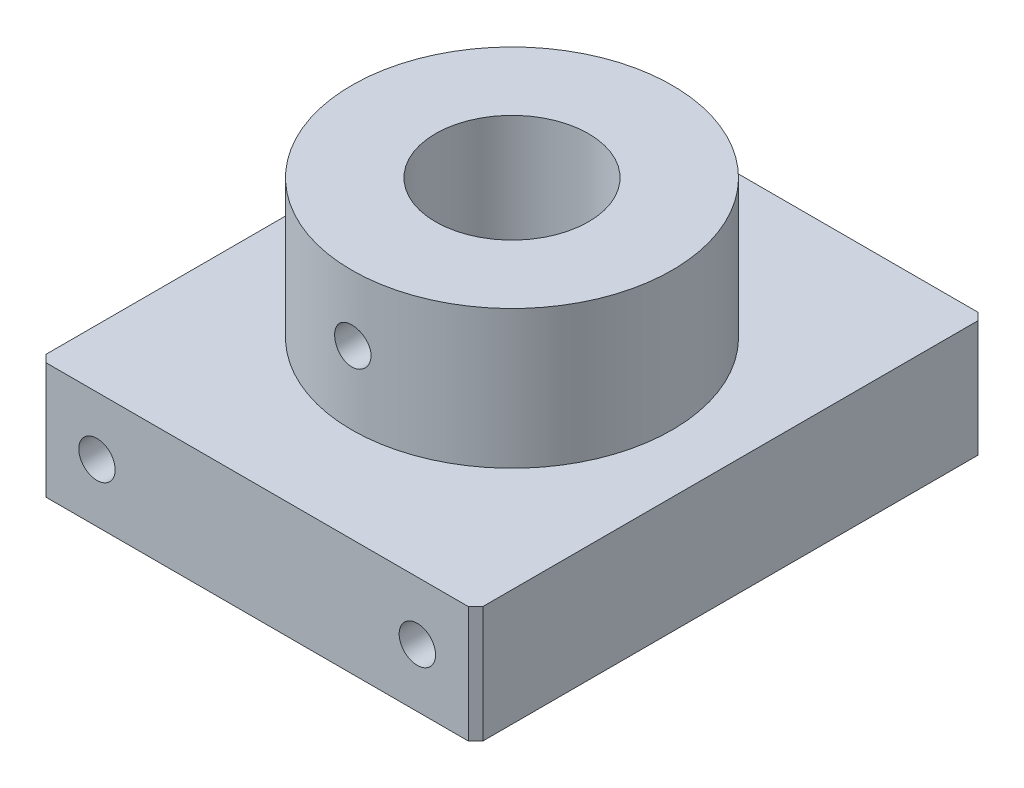
from build123d import *

# Parameters (mm, degrees)
SKETCH_1_W                  = 30
SKETCH_1_H                  = 35
EXTRUDE_1_DEPTH             = 10
SKETCH_3_R                  = 11
SKETCH_3_R_2                = 5.25
EXTRUDE_2_DEPTH             = 8.5
CHAMFER_1_SIZE              = 0.5
SKETCH_6_R                  = 5.25
CUT_EXTRUDE_3_DEPTH         = 30.555033412
SKETCH_7_W                  = 31.194113832
SKETCH_7_H                  = 36.870983812
CUT_EXTRUDE_4_DEPTH         = 1
CUT_EXTRUDE_START           = -1
SKETCH_8_W                  = 33.487798672
SKETCH_8_H                  = 37.788457748
SKETCH_8_R                  = 11
CUT_EXTRUDE_5_DEPTH         = 1
HOLE_WIZARD_M3_1_AT_2_COUNT = 2
HOLE_WIZARD_M3_1_AT_2_PITCH = 22
SKETCH_4_R                  = 1.25
CUT_EXTRUDE_6_DEPTH         = 30.555033412


with BuildPart() as part:
    # 草图1 → 凸台-拉伸1 (new body)
    with BuildSketch(Plane(origin=(0, 0, 0), x_dir=(1, 0, 0), z_dir=(0, 1, 0))):
        Rectangle(SKETCH_1_W, SKETCH_1_H)
    extrude(amount=EXTRUDE_1_DEPTH)

    # 草图3 → 凸台-拉伸2 (add)
    with BuildSketch(Plane(origin=(0, 10, 0), x_dir=(1, 0, 0), z_dir=(0, 1, 0))):
        with Locations(Location((0, 0, 0), (0, 0, 270))):
            Circle(SKETCH_3_R)
        with Locations(Location((0, 0, 0), (0, 0, 270))):
            Circle(SKETCH_3_R_2, mode=Mode.SUBTRACT)
    extrude(amount=EXTRUDE_2_DEPTH)

    # 倒角1
    chamfer_1_edges = [part.edges().sort_by_distance(p)[0] for p in [
        (15, 5, 17.5),
        (-15, 5, 17.5),
        (-15, 5, -17.5),
        (15, 5, -17.5),
    ]]
    chamfer(chamfer_1_edges, length=CHAMFER_1_SIZE)

    # 草图6 → 切除-拉伸3 (cut, through all)
    with BuildSketch(Plane(origin=(0, 18.5, 0), x_dir=(1, 0, 0), z_dir=(0, 1, 0))):
        with Locations(Location((0, 0, 0), (0, 0, 270))):
            Circle(SKETCH_6_R)
    extrude(amount=-CUT_EXTRUDE_3_DEPTH, mode=Mode.SUBTRACT)

    # 草图7 → 切除-拉伸4 (cut)
    with BuildSketch(Plane.XZ):
        Rectangle(SKETCH_7_W, SKETCH_7_H)
    extrude(amount=-CUT_EXTRUDE_4_DEPTH, mode=Mode.SUBTRACT)

    # 草图8 → 切除-拉伸5 (cut)
    with BuildSketch(Plane(origin=(0, 10, 0), x_dir=(1, 0, 0), z_dir=(0, 1, 0)).offset(CUT_EXTRUDE_START)):
        Rectangle(SKETCH_8_W, SKETCH_8_H)
        with Locations(Location((0, 0, 0), (0, 0, 270))):
            Circle(SKETCH_8_R, mode=Mode.SUBTRACT)
    extrude(amount=CUT_EXTRUDE_5_DEPTH, mode=Mode.SUBTRACT)

    # 草图9 → M3 螺纹孔1 (revolve, cut)
    with BuildSketch(Plane(origin=(-11, 5, 17.5), x_dir=(0, -1, 0), z_dir=(1, 0, 0))):
        Polygon((0, 0), (0, 8.751075774), (1.25, 8), (1.25, 0), align=None)
    hole_wizard_m3_1 = revolve(axis=Axis((-11, 5, 23.85), (0, 0, -1)), mode=Mode.SUBTRACT)

    # M3 螺纹孔1 at 2: M3 螺纹孔1 ×2
    with Locations(*[(i * HOLE_WIZARD_M3_1_AT_2_PITCH, 0, 0) for i in range(1, HOLE_WIZARD_M3_1_AT_2_COUNT)]):
        add(hole_wizard_m3_1, mode=Mode.SUBTRACT)

    # 镜向1: M3 螺纹孔1 across plane
    add(hole_wizard_m3_1.mirror(Plane.XY), mode=Mode.SUBTRACT)

    # 镜向1 copy 1 sketch → 镜向1 copy 1 (revolve, cut)
    with BuildSketch(Plane(origin=(11, 5, -17.5), x_dir=(0, -1, 0), z_dir=(1, 0, 0))):
        Polygon((0, 0), (0, -8.751075774), (1.25, -8), (1.25, 0), align=None)
    revolve(axis=Axis((11, 5, -23.85), (0, 0, -1)), mode=Mode.SUBTRACT)

    # 草图4 → 切除-拉伸6 (cut, through all)
    with BuildSketch(Plane.XY):
        with Locations(Location((0, 14, 0), (0, 0, 180))):
            Circle(SKETCH_4_R)
    extrude(amount=CUT_EXTRUDE_6_DEPTH, mode=Mode.SUBTRACT)


solid = part.part
